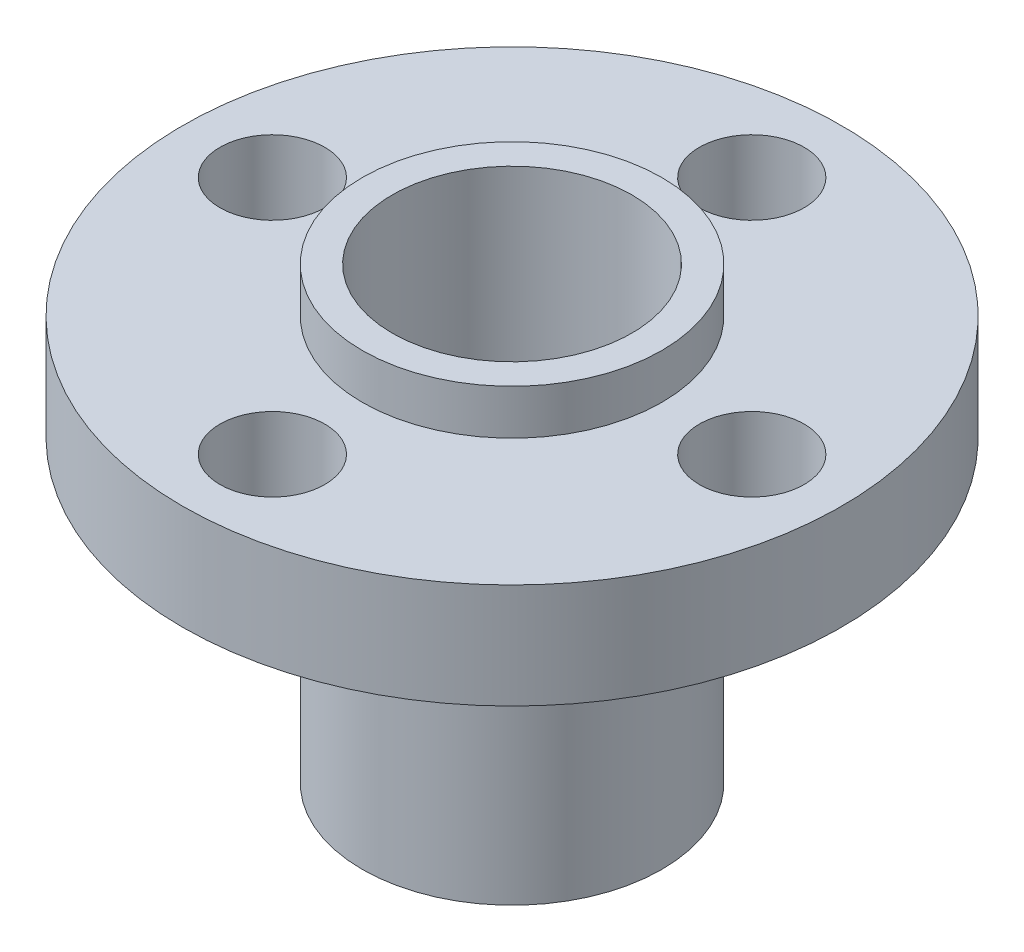
from build123d import *

# Parameters (mm, degrees)
SKETCH_1_R          = 5
SKETCH_1_R_2        = 4
EXTRUDE_1_DEPTH     = 10
SKETCH_2_R          = 11
SKETCH_2_R_2        = 4
EXTRUDE_2_DEPTH     = 3.5
SKETCH_3_R          = 5
SKETCH_3_R_2        = 4
EXTRUDE_3_DEPTH     = 1.5
SKETCH_4_R          = 1.75
CUT_EXTRUDE_1_DEPTH = 21.597329924


with BuildPart() as part:
    # 草图1 → 凸台-拉伸1 (new body)
    with BuildSketch(Plane(origin=(0, 0, 0), x_dir=(1, 0, 0), z_dir=(0, 1, 0))):
        with Locations(Location((0, 0, 0), (0, 0, 270))):
            Circle(SKETCH_1_R)
        with Locations(Location((0, 0, 0), (0, 0, 270))):
            Circle(SKETCH_1_R_2, mode=Mode.SUBTRACT)
    extrude(amount=EXTRUDE_1_DEPTH)

    # 草图2 → 凸台-拉伸2 (add)
    with BuildSketch(Plane(origin=(0, 10, 0), x_dir=(1, 0, 0), z_dir=(0, 1, 0))):
        with Locations(Location((0, 0, 0), (0, 0, 270))):
            Circle(SKETCH_2_R)
        with Locations(Location((0, 0, 0), (0, 0, 270))):
            Circle(SKETCH_2_R_2, mode=Mode.SUBTRACT)
    extrude(amount=EXTRUDE_2_DEPTH)

    # 草图3 → 凸台-拉伸3 (add)
    with BuildSketch(Plane(origin=(0, 13.5, 0), x_dir=(1, 0, 0), z_dir=(0, 1, 0))):
        with Locations(Location((0, 0, 0), (0, 0, 270))):
            Circle(SKETCH_3_R)
        with Locations(Location((0, 0, 0), (0, 0, 270))):
            Circle(SKETCH_3_R_2, mode=Mode.SUBTRACT)
    extrude(amount=EXTRUDE_3_DEPTH)

    # 草图4 → 切除-拉伸1 (cut, through all)
    with BuildSketch(Plane(origin=(0, 13.5, 0), x_dir=(1, 0, 0), z_dir=(0, 1, 0))):
        with Locations(Location((-8, 0, 0), (0, 0, 270))):
            Circle(SKETCH_4_R)
        with Locations(Location((0, 8, 0), (0, 0, 270))):
            Circle(SKETCH_4_R)
        with Locations(Location((8, 0, 0), (0, 0, 270))):
            Circle(SKETCH_4_R)
        with Locations(Location((0, -8, 0), (0, 0, 270))):
            Circle(SKETCH_4_R)
    extrude(amount=-CUT_EXTRUDE_1_DEPTH, mode=Mode.SUBTRACT)


solid = part.part
